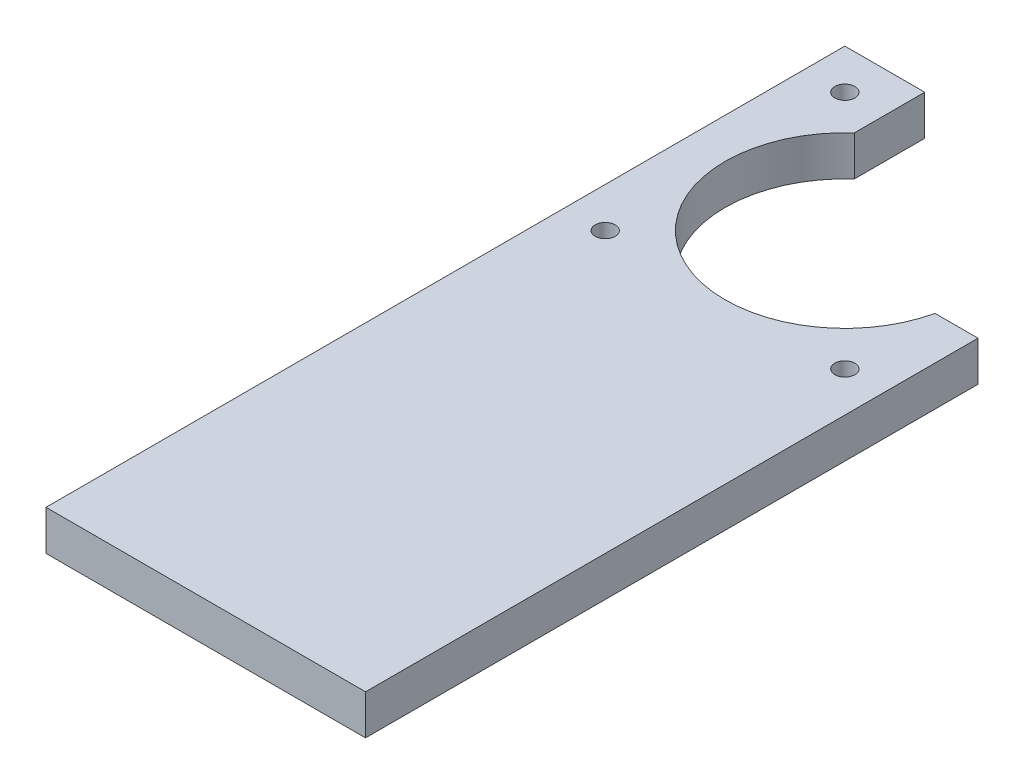
from build123d import *

# Parameters (mm, degrees)
SKETCH1_R      = 2.3876
EXTRUDE1_DEPTH = 9.525


with BuildPart() as part:
    # Sketch1 → Extrude1 (new body)
    with BuildSketch(Plane(origin=(0, 0, 0), x_dir=(1, 0, 0), z_dir=(0, 1, 0))):
        with BuildLine():
            Line((-38.1, 38.1), (-38.1, -152.4))
            Line((-38.1, -152.4), (38.1, -152.4))
            Line((38.1, -152.4), (38.1, -6.35))
            Line((38.1, -6.35), (27.86051193, -6.35))
            ThreePointArc((27.86051193, -6.35), (-14.509197932, -24.617347549), (-19.05, 21.298547486))
            Line((-19.05, 21.298547486), (-19.05, 38.1))
            Line((-19.05, 38.1), (-38.1, 38.1))
        make_face()
        with Locations((-28.575, 28.575)):
            Circle(SKETCH1_R, mode=Mode.SUBTRACT)
        with Locations((28.575, -28.575)):
            Circle(SKETCH1_R, mode=Mode.SUBTRACT)
        with Locations((-28.575, -28.575)):
            Circle(SKETCH1_R, mode=Mode.SUBTRACT)
    extrude(amount=-EXTRUDE1_DEPTH)


solid = part.part
